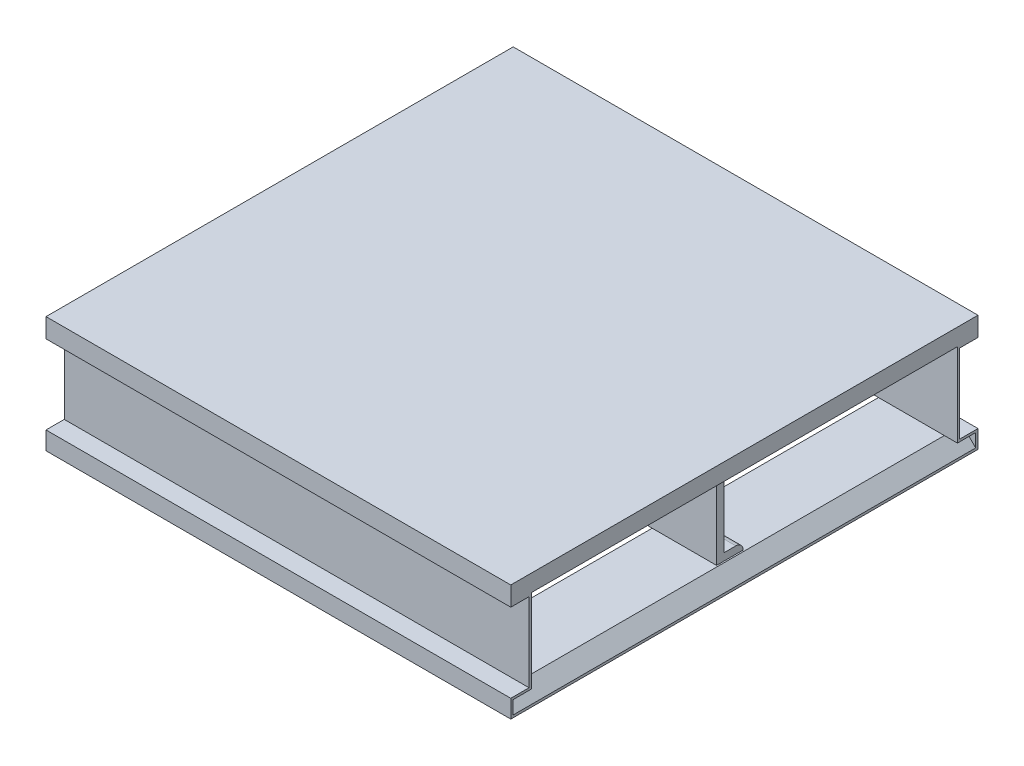
from build123d import *

# Parameters (mm, degrees)
BOSS_EXTRUDE1_DEPTH      = 306.3875
BOSS_EXTRUDE1_2_DEPTH    = 306.3875
BOSS_EXTRUDE1_3_DEPTH    = 306.3875
SKETCH3_W                = 120.65
SKETCH3_H                = 19.685
BOSS_EXTRUDE1_4_DEPTH    = 306.3875
LPATTERN1_COUNT          = 3
LPATTERN1_PITCH          = 244.475
BOSS_EXTRUDE2_DEPTH      = 304.8
SKETCH5_W                = 606.679
SKETCH5_H                = 2.54
BOSS_EXTRUDE3_DEPTH      = 609.6
BOSS_EXTRUDE4_DEPTH      = 285.75
BOSS_EXTRUDE4_DEPTH_BACK = 285.75


with BuildPart() as part:
    # Sketch3 → Boss-Extrude1 (new, symmetric)
    with BuildSketch(Plane.XY):
        Polygon((-304.8, -76.2), (-304.8, -73.025), (-287.655, -55.5625), (-201.295, -55.5625), (-184.15, -73.025), (-184.15, -76.2), align=None)
    extrude(amount=BOSS_EXTRUDE1_DEPTH, both=True)



with BuildPart() as body_2:
    # Sketch3 → Boss-Extrude1 2 (new, symmetric)
    with BuildSketch(Plane.XY):
        Polygon((184.15, -73.025), (184.15, -76.2), (304.8, -76.2), (304.8, -73.025), (287.655, -55.5625), (201.295, -55.5625), align=None)
    extrude(amount=BOSS_EXTRUDE1_2_DEPTH, both=True)


with BuildPart() as body_3:
    # Sketch3 → Boss-Extrude1 3 (new, symmetric)
    with BuildSketch(Plane.XY):
        Polygon((-60.325, -76.2), (60.325, -76.2), (60.325, -73.025), (43.18, -55.5625), (-43.18, -55.5625), (-60.325, -73.025), align=None)
    extrude(amount=BOSS_EXTRUDE1_3_DEPTH, both=True)


with BuildPart() as body_4:
    # Sketch3 → Boss-Extrude1 4 (new, symmetric)
    with BuildSketch(Plane.XY):
        with Locations((-244.475, 63.8175)):
            Rectangle(SKETCH3_W, SKETCH3_H)
    extrude(amount=BOSS_EXTRUDE1_4_DEPTH, both=True)


with BuildPart() as lpattern1_1:
    # LPattern1: pattern copy
    add(body_4.part.moved(Location(Vector(1, 0, 0) * (1 * LPATTERN1_PITCH))))


with BuildPart() as lpattern1_2:
    # LPattern1: pattern copy
    add(body_4.part.moved(Location(Vector(1, 0, 0) * (2 * LPATTERN1_PITCH))))


with BuildPart() as part_1:
    add(part.part)

    add(body_2.part)  # Boss-Extrude2 merges body 2

    add(body_3.part)  # Boss-Extrude2 merges body 3

    add(body_4.part)  # Boss-Extrude2 merges body 4

    add(lpattern1_1.part)  # Boss-Extrude2 merges LPattern1_1

    add(lpattern1_2.part)  # Boss-Extrude2 merges LPattern1_2
    # Sketch4 → Boss-Extrude2 (add, symmetric)
    with BuildSketch(Plane(origin=(0, 0, 0), x_dir=(0, 0, -1), z_dir=(1, 0, 0))):
        Polygon((-306.3875, 76.2), (-306.3875, 50.927), (-282.448, 50.927), (-282.448, -52.5145), (-306.3875, -52.5145), (-306.3875, -76.2), (-303.3395, -76.2), (-303.3395, -55.5625), (-279.4, -55.5625), (-279.4, 53.975), (-303.3395, 53.975), (-303.3395, 76.2), align=None)
        Polygon((303.3395, 53.975), (303.3395, 76.2), (306.3875, 76.2), (306.3875, 50.927), (282.448, 50.927), (282.448, -52.5145), (306.3875, -52.5145), (306.3875, -76.2), (303.3395, -76.2), (303.3395, -55.5625), (279.4, -55.5625), (279.4, 53.975), align=None)
    extrude(amount=BOSS_EXTRUDE2_DEPTH, both=True)

    # Sketch5 → Boss-Extrude3 (add)
    with BuildSketch(Plane(origin=(304.8, 0, 0), x_dir=(0, 0, -1), z_dir=(1, 0, 0))):
        with Locations((0, 74.93)):
            Rectangle(SKETCH5_W, SKETCH5_H)
    extrude(amount=-BOSS_EXTRUDE3_DEPTH)

    # Sketch6 → Boss-Extrude4 (add, two sides: drawn at the far end of the back side and taken through both)
    with BuildSketch(Plane(origin=(0, 0, 0), x_dir=(0, 0, -1), z_dir=(1, 0, 0)).offset(-BOSS_EXTRUDE4_DEPTH_BACK)):
        with BuildLine():
            Line((-17.4625, 53.975), (-17.4625, -55.5625))
            Line((-17.4625, -55.5625), (17.4625, -55.5625))
            ThreePointArc((17.4625, -55.5625), (14.672692091, -48.827307909), (7.9375, -46.0375))
            Line((7.9375, -46.0375), (-7.9375, -46.0375))
            Line((-7.9375, -46.0375), (-7.9375, 44.45))
            Line((-7.9375, 44.45), (7.9375, 44.45))
            ThreePointArc((7.9375, 44.45), (14.672692091, 47.239807909), (17.4625, 53.975))
            Line((17.4625, 53.975), (-17.4625, 53.975))
        make_face()
    extrude(amount=BOSS_EXTRUDE4_DEPTH + BOSS_EXTRUDE4_DEPTH_BACK)


solid = part_1.part
